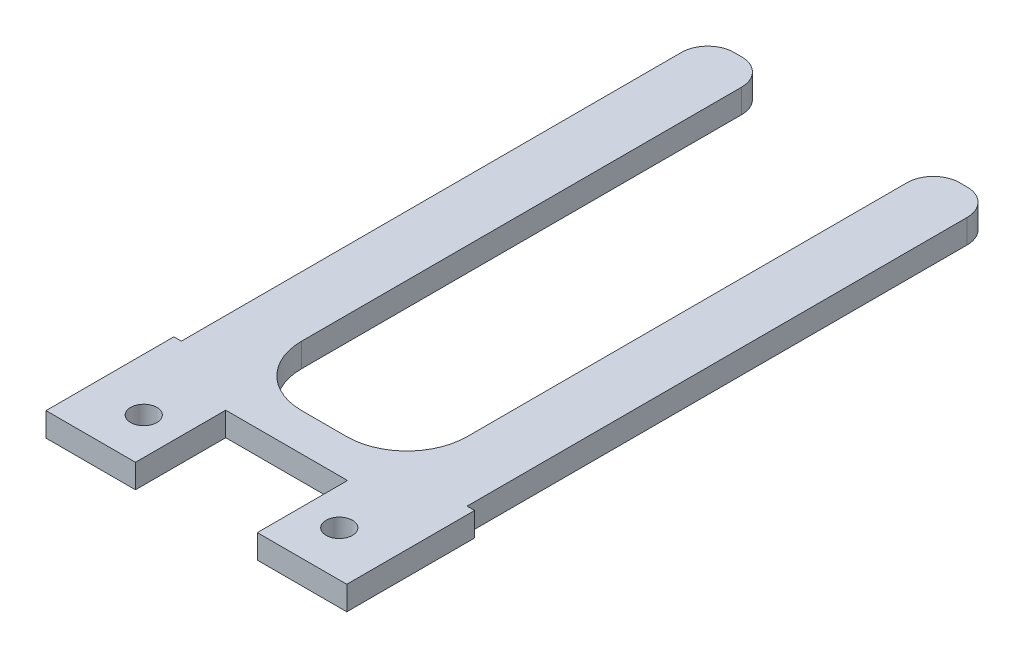
from build123d import *

# Parameters (mm, degrees)
CROQUIS1_R              = 1.75
SALIENTE_EXTRUIR1_DEPTH = 1.5875
REDONDEO1_R             = 8


with BuildPart() as part:
    # Croquis1 → Saliente-Extruir1 (new, symmetric)
    with BuildSketch(Plane(origin=(0, 0, 0), x_dir=(1, 0, 0), z_dir=(0, 1, 0))):
        with BuildLine():
            Line((8.1, 0), (-8.1, 0))
            Line((-8.1, 0), (-8.1, -12))
            Line((-8.1, -12), (-20, -12))
            Line((-20, -12), (-20, 5))
            Line((-20, 5), (-19, 5))
            Line((-19, 5), (-19, 71.5))
            ThreePointArc((-19, 71.5), (-17.974873734, 73.974873734), (-15.5, 75))
            Line((-15.5, 75), (-14.5, 75))
            ThreePointArc((-14.5, 75), (-12.025126266, 73.974873734), (-11, 71.5))
            Line((-11, 71.5), (-11, 5))
            Line((-11, 5), (11, 5))
            Line((11, 5), (11, 71.5))
            ThreePointArc((11, 71.5), (12.025126266, 73.974873734), (14.5, 75))
            Line((14.5, 75), (15.5, 75))
            ThreePointArc((15.5, 75), (17.974873734, 73.974873734), (19, 71.5))
            Line((19, 71.5), (19, 5))
            Line((19, 5), (20, 5))
            Line((20, 5), (20, -12))
            Line((20, -12), (8.1, -12))
            Line((8.1, -12), (8.1, 0))
        make_face()
        with Locations(Location((-13, -6, 0), (0, 0, 270))):
            Circle(CROQUIS1_R, mode=Mode.SUBTRACT)
        with Locations(Location((13, -6, 0), (0, 0, 270))):
            Circle(CROQUIS1_R, mode=Mode.SUBTRACT)
    extrude(amount=SALIENTE_EXTRUIR1_DEPTH, both=True)

    # Redondeo1
    redondeo1_edges = [part.edges().sort_by_distance(p)[0] for p in [
        (-11, 0, -5),
        (11, 0, -5),
    ]]
    fillet(redondeo1_edges, radius=REDONDEO1_R)


solid = part.part
